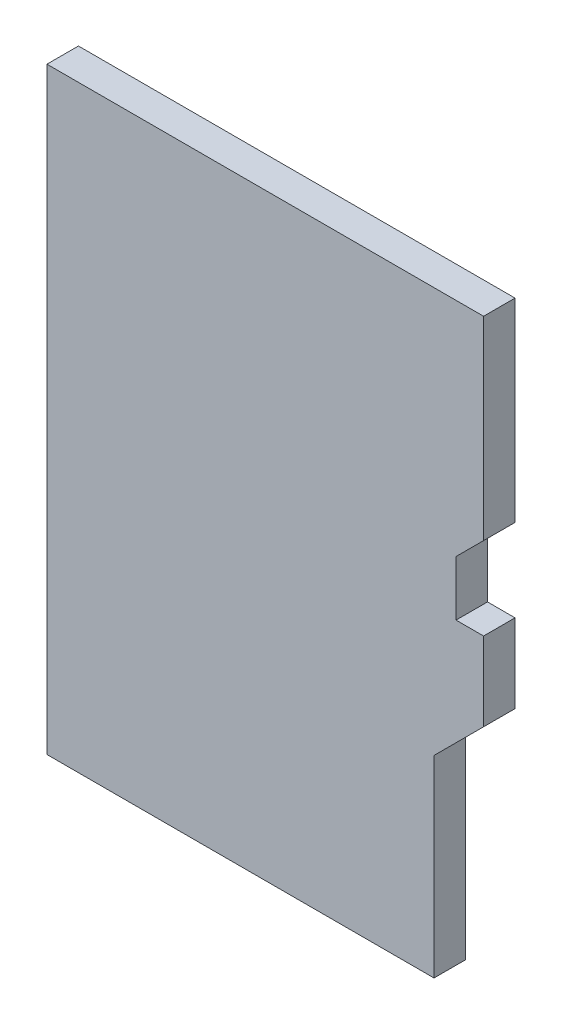
from build123d import *

# Parameters (mm, degrees)
CROQUIS1_W              = 9.84
CROQUIS1_H              = 4.9
SALIENTE_EXTRUIR1_DEPTH = 0.8


with BuildPart() as part:
    # Croquis1 → Saliente-Extruir1 (new body)
    with BuildSketch(Plane.XY):
        Polygon((-5.55, -2.7), (4.29, -2.7), (5.55, -1.44), (5.55, 0.56), (4.85, 0.56), (4.85, 1.96), (5.55, 2.66), (5.55, 7.6), (-5.55, 7.6), align=None)
        with Locations((-0.63, -5.15)):
            Rectangle(CROQUIS1_W, CROQUIS1_H)
    extrude(amount=SALIENTE_EXTRUIR1_DEPTH)


solid = part.part
